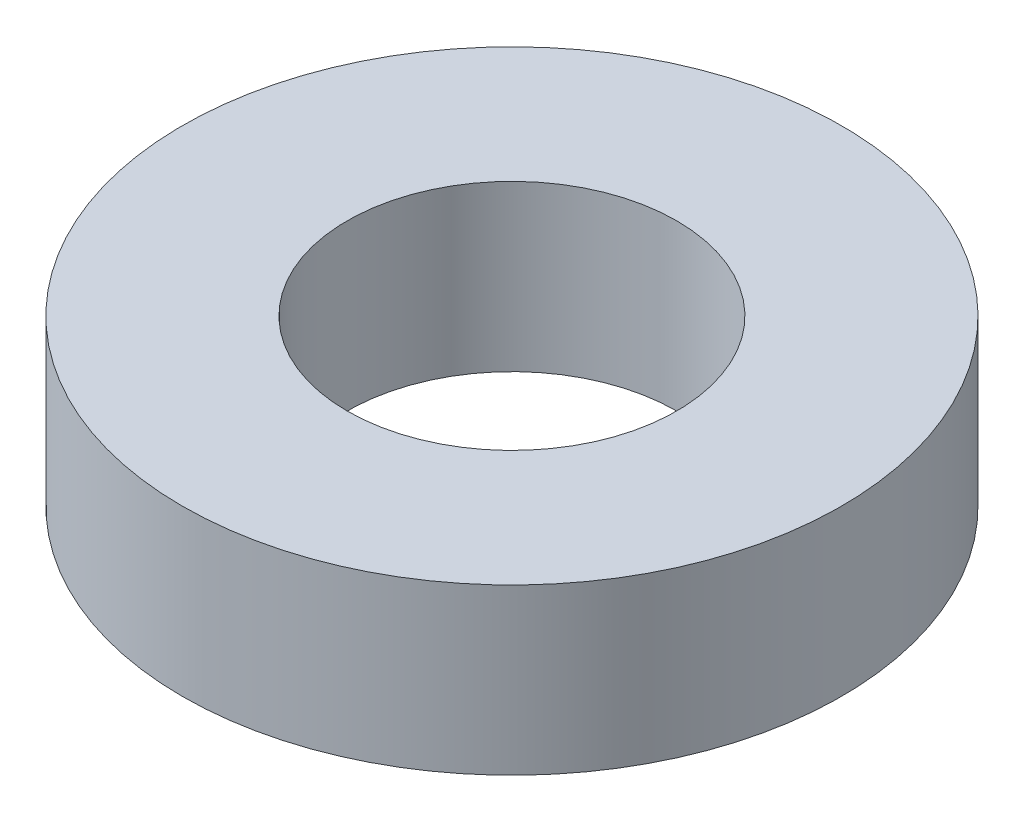
from build123d import *

# Parameters (mm, degrees)
SKETCH1_R           = 12.7
SKETCH1_R_2         = 6.35
BOSS_EXTRUDE1_DEPTH = 6.35


with BuildPart() as part:
    # Sketch1 → Boss-Extrude1 (new body)
    with BuildSketch(Plane(origin=(0, 0, 0), x_dir=(1, 0, 0), z_dir=(0, 1, 0))):
        with Locations(Location((0, 0, 0), (0, 0, 270))):
            Circle(SKETCH1_R)
        with Locations(Location((0, 0, 0), (0, 0, 270))):
            Circle(SKETCH1_R_2, mode=Mode.SUBTRACT)
    extrude(amount=BOSS_EXTRUDE1_DEPTH)


solid = part.part
